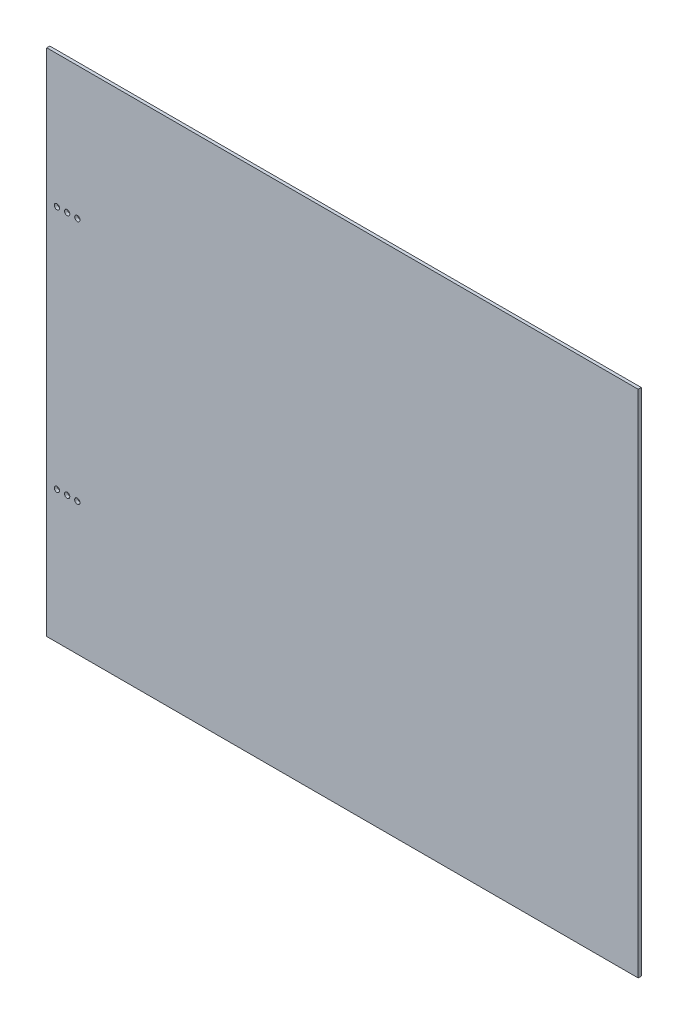
from build123d import *

# Parameters (mm, degrees)
SKETCH_1_W      = 580
SKETCH_1_H      = 500
SKETCH_1_R      = 2.6
EXTRUDE_1_DEPTH = 3


with BuildPart() as part:
    # 草图1 → 凸台-拉伸1 (new body)
    with BuildSketch(Plane.XY):
        with Locations((290, 250)):
            Rectangle(SKETCH_1_W, SKETCH_1_H)
        with Locations((10, 370)):
            Circle(SKETCH_1_R, mode=Mode.SUBTRACT)
        with Locations((10, 130)):
            Circle(SKETCH_1_R, mode=Mode.SUBTRACT)
        with Locations((20, 130)):
            Circle(SKETCH_1_R, mode=Mode.SUBTRACT)
        with Locations((20, 370)):
            Circle(SKETCH_1_R, mode=Mode.SUBTRACT)
        with Locations((30, 130)):
            Circle(SKETCH_1_R, mode=Mode.SUBTRACT)
        with Locations((30, 370)):
            Circle(SKETCH_1_R, mode=Mode.SUBTRACT)
    extrude(amount=EXTRUDE_1_DEPTH)


solid = part.part
